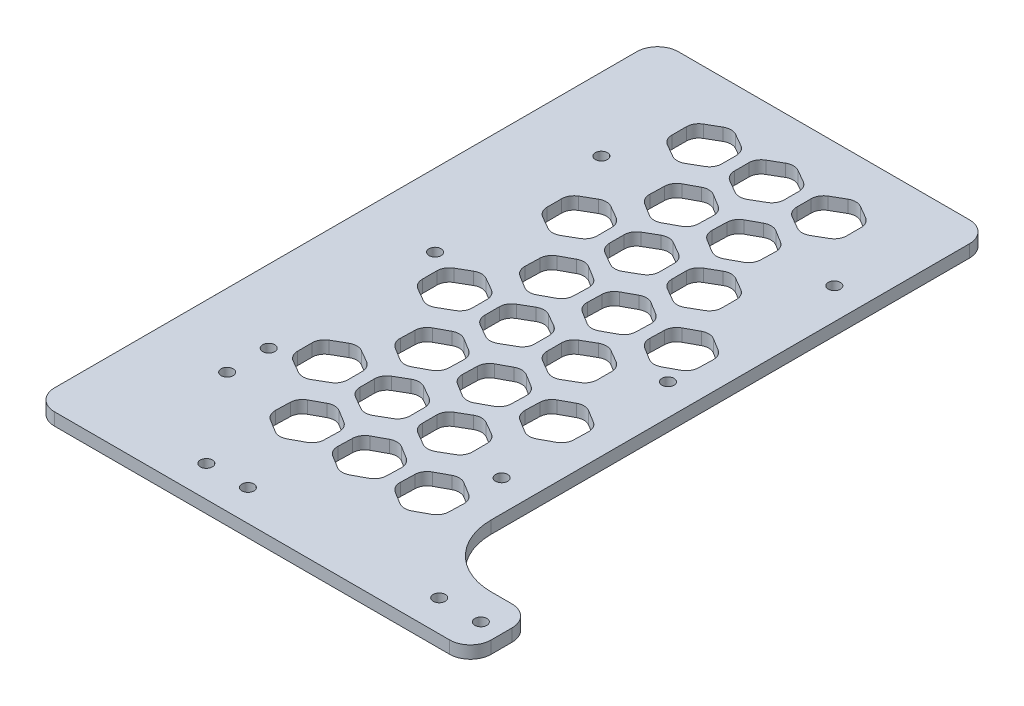
from build123d import *

# Parameters (mm, degrees)
SKETCH_1_R          = 1.45
EXTRUDE_1_DEPTH     = 3
FILLET_1_R          = 5
FILLET_2_R          = 15
SKETCH_2_R          = 1.45
CUT_EXTRUDE_1_DEPTH = 100.292497199
SKETCH_3_R          = 1.45
CUT_EXTRUDE_2_DEPTH = 100.292497199
CUT_EXTRUDE_3_DEPTH = 100.292497199
FILLET_3_R          = 3


with BuildPart() as part:
    # 草图1 → 凸台-拉伸1 (new body)
    with BuildSketch(Plane(origin=(0, 0, 0), x_dir=(1, 0, 0), z_dir=(0, 1, 0))):
        Polygon((40, 75), (40, -60), (65, -60), (65, -75), (40, -75), (-40, -75), (-40, 75), align=None)
        with Locations(Location((50, -67.5, 0), (0, 0, 270))):
            Circle(SKETCH_1_R, mode=Mode.SUBTRACT)
        with Locations(Location((60, -67.5, 0), (0, 0, 270))):
            Circle(SKETCH_1_R, mode=Mode.SUBTRACT)
    extrude(amount=EXTRUDE_1_DEPTH)

    # 圆角1
    fillet_1_edges = [part.edges().sort_by_distance(p)[0] for p in [
        (40, 1.5, -75),
        (65, 1.5, 60),
        (65, 1.5, 75),
        (-40, 1.5, 75),
        (-40, 1.5, -75),
    ]]
    fillet(fillet_1_edges, radius=FILLET_1_R)

    # 圆角2
    fillet_2_edges = [part.edges().sort_by_distance(p)[0] for p in [
        (40, 1.5, 60),
    ]]
    fillet(fillet_2_edges, radius=FILLET_2_R)

    # 草图2 → 切除-拉伸1 (cut, through all)
    with BuildSketch(Plane(origin=(0, 3, 0), x_dir=(1, 0, 0), z_dir=(0, 1, 0))):
        with Locations(Location((4, -67.5, 0), (0, 0, 270))):
            Circle(SKETCH_2_R)
        with Locations(Location((-6, -67.5, 0), (0, 0, 270))):
            Circle(SKETCH_2_R)
        with Locations(Location((-22.5, -46, 0), (0, 0, 270))):
            Circle(SKETCH_2_R)
        with Locations(Location((-22.5, -36, 0), (0, 0, 270))):
            Circle(SKETCH_2_R)
    extrude(amount=-CUT_EXTRUDE_1_DEPTH, mode=Mode.SUBTRACT)

    # 草图3 → 切除-拉伸2 (cut, through all)
    with BuildSketch(Plane(origin=(0, 3, 0), x_dir=(1, 0, 0), z_dir=(0, 1, 0))):
        with Locations(Location((32.5, -35, 0), (0, 0, 270))):
            Circle(SKETCH_3_R)
        with Locations(Location((32.5, 5, 0), (0, 0, 270))):
            Circle(SKETCH_3_R)
        with Locations(Location((32.5, 45, 0), (0, 0, 270))):
            Circle(SKETCH_3_R)
        with Locations(Location((-22.5, 44, 0), (0, 0, 270))):
            Circle(SKETCH_3_R)
        with Locations(Location((-22.5, 4, 0), (0, 0, 270))):
            Circle(SKETCH_3_R)
    extrude(amount=-CUT_EXTRUDE_2_DEPTH, mode=Mode.SUBTRACT)

    # 草图4 → 切除-拉伸3 (cut, through all)
    with BuildSketch(Plane(origin=(0, 3, 0), x_dir=(1, 0, 0), z_dir=(0, 1, 0))):
        Polygon((8.589283576, 62.082534222), (2.589283576, 65.546635837), (-3.410716424, 62.082534222), (-3.410716424, 55.154330992), (2.589283576, 51.690229377), (8.589283576, 55.154330992), align=None)
        Polygon((-6.410716424, 62.082534222), (-12.410716424, 65.546635837), (-18.410716424, 62.082534222), (-18.410716424, 55.154330992), (-12.410716424, 51.690229377), (-6.410716424, 55.154330992), align=None)
        Polygon((3.395495003, 46.736023545), (-2.504116798, 50.368458074), (-8.599703277, 47.075461646), (-8.795677957, 40.150030691), (-2.896066156, 36.517596162), (3.199520323, 39.810592589), align=None)
        Polygon((18.395495003, 46.736023545), (12.495883202, 50.368458074), (6.400296723, 47.075461646), (6.204322043, 40.150030691), (12.103933844, 36.517596162), (18.199520323, 39.810592589), align=None)
        Polygon((23.589283576, 62.082534222), (17.589283576, 65.546635837), (11.589283576, 62.082534222), (11.589283576, 55.154330992), (17.589283576, 51.690229377), (23.589283576, 55.154330992), align=None)
        Polygon((8.589283576, 32.082534222), (2.589283576, 35.546635837), (-3.410716424, 32.082534222), (-3.410716424, 25.154330992), (2.589283576, 21.690229377), (8.589283576, 25.154330992), align=None)
        Polygon((18.395495003, 16.736023545), (12.495883202, 20.368458074), (6.400296723, 17.075461646), (6.204322043, 10.150030691), (12.103933844, 6.517596162), (18.199520323, 9.810592589), align=None)
        Polygon((23.589283576, 32.082534222), (17.589283576, 35.546635837), (11.589283576, 32.082534222), (11.589283576, 25.154330992), (17.589283576, 21.690229377), (23.589283576, 25.154330992), align=None)
        Polygon((33.395495003, 16.736023545), (27.495883202, 20.368458074), (21.400296723, 17.075461646), (21.204322043, 10.150030691), (27.103933844, 6.517596162), (33.199520323, 9.810592589), align=None)
        Polygon((8.589283576, 2.082534222), (2.589283576, 5.546635837), (-3.410716424, 2.082534222), (-3.410716424, -4.845669008), (2.589283576, -8.309770623), (8.589283576, -4.845669008), align=None)
        Polygon((18.395495003, -13.263976455), (12.495883202, -9.631541926), (6.400296723, -12.924538354), (6.204322043, -19.849969309), (12.103933844, -23.482403838), (18.199520323, -20.189407411), align=None)
        Polygon((23.589283576, 2.082534222), (17.589283576, 5.546635837), (11.589283576, 2.082534222), (11.589283576, -4.845669008), (17.589283576, -8.309770623), (23.589283576, -4.845669008), align=None)
        Polygon((33.395495003, -13.263976455), (27.495883202, -9.631541926), (21.400296723, -12.924538354), (21.204322043, -19.849969309), (27.103933844, -23.482403838), (33.199520323, -20.189407411), align=None)
        Polygon((8.589283576, -27.917465778), (2.589283576, -24.453364163), (-3.410716424, -27.917465778), (-3.410716424, -34.845669008), (2.589283576, -38.309770623), (8.589283576, -34.845669008), align=None)
        Polygon((18.395495003, -43.263976455), (12.495883202, -39.631541926), (6.400296723, -42.924538354), (6.204322043, -49.849969309), (12.103933844, -53.482403838), (18.199520323, -50.189407411), align=None)
        Polygon((23.589283576, -27.917465778), (17.589283576, -24.453364163), (11.589283576, -27.917465778), (11.589283576, -34.845669008), (17.589283576, -38.309770623), (23.589283576, -34.845669008), align=None)
        Polygon((33.395495003, -43.263976455), (27.495883202, -39.631541926), (21.400296723, -42.924538354), (21.204322043, -49.849969309), (27.103933844, -53.482403838), (33.199520323, -50.189407411), align=None)
        Polygon((-6.410716424, 32.082534222), (-12.410716424, 35.546635837), (-18.410716424, 32.082534222), (-18.410716424, 25.154330992), (-12.410716424, 21.690229377), (-6.410716424, 25.154330992), align=None)
        Polygon((3.395495003, 16.736023545), (-2.504116798, 20.368458074), (-8.599703277, 17.075461646), (-8.795677957, 10.150030691), (-2.896066156, 6.517596162), (3.199520323, 9.810592589), align=None)
        Polygon((-6.410716424, 2.082534222), (-12.410716424, 5.546635837), (-18.410716424, 2.082534222), (-18.410716424, -4.845669008), (-12.410716424, -8.309770623), (-6.410716424, -4.845669008), align=None)
        Polygon((3.395495003, -13.263976455), (-2.504116798, -9.631541926), (-8.599703277, -12.924538354), (-8.795677957, -19.849969309), (-2.896066156, -23.482403838), (3.199520323, -20.189407411), align=None)
        Polygon((-6.410716424, -27.917465778), (-12.410716424, -24.453364163), (-18.410716424, -27.917465778), (-18.410716424, -34.845669008), (-12.410716424, -38.309770623), (-6.410716424, -34.845669008), align=None)
        Polygon((3.395495003, -43.263976455), (-2.504116798, -39.631541926), (-8.599703277, -42.924538354), (-8.795677957, -49.849969309), (-2.896066156, -53.482403838), (3.199520323, -50.189407411), align=None)
    extrude(amount=-CUT_EXTRUDE_3_DEPTH, mode=Mode.SUBTRACT)

    # 圆角3
    fillet_3_edges = [part.edges().sort_by_distance(p)[0] for p in [
        (23.589283576, 1.5, -62.082534222),
        (23.589283576, 1.5, -55.154330992),
        (17.589283576, 1.5, -51.690229377),
        (11.589283576, 1.5, -55.154330992),
        (11.589283576, 1.5, -62.082534222),
        (17.589283576, 1.5, -65.546635837),
        (18.395495003, 1.5, -46.736023545),
        (18.199520323, 1.5, -39.810592589),
        (12.103933844, 1.5, -36.517596162),
        (6.204322043, 1.5, -40.150030691),
        (6.400296723, 1.5, -47.075461646),
        (12.495883202, 1.5, -50.368458074),
        (8.589283576, 1.5, -62.082534222),
        (8.589283576, 1.5, -55.154330992),
        (2.589283576, 1.5, -51.690229377),
        (-3.410716424, 1.5, -55.154330992),
        (-3.410716424, 1.5, -62.082534222),
        (2.589283576, 1.5, -65.546635837),
        (3.395495003, 1.5, -46.736023545),
        (3.199520323, 1.5, -39.810592589),
        (-2.896066156, 1.5, -36.517596162),
        (-8.795677957, 1.5, -40.150030691),
        (-8.599703277, 1.5, -47.075461646),
        (-2.504116798, 1.5, -50.368458074),
        (33.395495003, 1.5, -16.736023545),
        (33.199520323, 1.5, -9.810592589),
        (27.103933844, 1.5, -6.517596162),
        (21.204322043, 1.5, -10.150030691),
        (21.400296723, 1.5, -17.075461646),
        (27.495883202, 1.5, -20.368458074),
        (23.589283576, 1.5, -32.082534222),
        (23.589283576, 1.5, -25.154330992),
        (17.589283576, 1.5, -21.690229377),
        (11.589283576, 1.5, -25.154330992),
        (11.589283576, 1.5, -32.082534222),
        (17.589283576, 1.5, -35.546635837),
        (18.395495003, 1.5, -16.736023545),
        (18.199520323, 1.5, -9.810592589),
        (12.103933844, 1.5, -6.517596162),
        (6.204322043, 1.5, -10.150030691),
        (6.400296723, 1.5, -17.075461646),
        (12.495883202, 1.5, -20.368458074),
        (8.589283576, 1.5, -32.082534222),
        (8.589283576, 1.5, -25.154330992),
        (2.589283576, 1.5, -21.690229377),
        (-3.410716424, 1.5, -25.154330992),
        (-3.410716424, 1.5, -32.082534222),
        (2.589283576, 1.5, -35.546635837),
        (33.395495003, 1.5, 13.263976455),
        (33.199520323, 1.5, 20.189407411),
        (27.103933844, 1.5, 23.482403838),
        (21.204322043, 1.5, 19.849969309),
        (21.400296723, 1.5, 12.924538354),
        (27.495883202, 1.5, 9.631541926),
        (23.589283576, 1.5, -2.082534222),
        (23.589283576, 1.5, 4.845669008),
        (17.589283576, 1.5, 8.309770623),
        (11.589283576, 1.5, 4.845669008),
        (11.589283576, 1.5, -2.082534222),
        (17.589283576, 1.5, -5.546635837),
        (18.395495003, 1.5, 13.263976455),
        (18.199520323, 1.5, 20.189407411),
        (12.103933844, 1.5, 23.482403838),
        (6.204322043, 1.5, 19.849969309),
        (6.400296723, 1.5, 12.924538354),
        (12.495883202, 1.5, 9.631541926),
        (8.589283576, 1.5, -2.082534222),
        (8.589283576, 1.5, 4.845669008),
        (2.589283576, 1.5, 8.309770623),
        (-3.410716424, 1.5, 4.845669008),
        (-3.410716424, 1.5, -2.082534222),
        (2.589283576, 1.5, -5.546635837),
        (33.395495003, 1.5, 43.263976455),
        (33.199520323, 1.5, 50.189407411),
        (27.103933844, 1.5, 53.482403838),
        (21.204322043, 1.5, 49.849969309),
        (21.400296723, 1.5, 42.924538354),
        (27.495883202, 1.5, 39.631541926),
        (23.589283576, 1.5, 27.917465778),
        (23.589283576, 1.5, 34.845669008),
        (17.589283576, 1.5, 38.309770623),
        (11.589283576, 1.5, 34.845669008),
        (11.589283576, 1.5, 27.917465778),
        (17.589283576, 1.5, 24.453364163),
        (18.395495003, 1.5, 43.263976455),
        (18.199520323, 1.5, 50.189407411),
        (12.103933844, 1.5, 53.482403838),
        (6.204322043, 1.5, 49.849969309),
        (6.400296723, 1.5, 42.924538354),
        (12.495883202, 1.5, 39.631541926),
        (8.589283576, 1.5, 27.917465778),
        (8.589283576, 1.5, 34.845669008),
        (2.589283576, 1.5, 38.309770623),
        (-3.410716424, 1.5, 34.845669008),
        (-3.410716424, 1.5, 27.917465778),
        (2.589283576, 1.5, 24.453364163),
        (-6.410716424, 1.5, -32.082534222),
        (-6.410716424, 1.5, -25.154330992),
        (-12.410716424, 1.5, -21.690229377),
        (-18.410716424, 1.5, -25.154330992),
        (-18.410716424, 1.5, -32.082534222),
        (-12.410716424, 1.5, -35.546635837),
        (3.395495003, 1.5, -16.736023545),
        (3.199520323, 1.5, -9.810592589),
        (-2.896066156, 1.5, -6.517596162),
        (-8.795677957, 1.5, -10.150030691),
        (-8.599703277, 1.5, -17.075461646),
        (-2.504116798, 1.5, -20.368458074),
        (-6.410716424, 1.5, -2.082534222),
        (-6.410716424, 1.5, 4.845669008),
        (-12.410716424, 1.5, 8.309770623),
        (-18.410716424, 1.5, 4.845669008),
        (-18.410716424, 1.5, -2.082534222),
        (-12.410716424, 1.5, -5.546635837),
        (3.395495003, 1.5, 13.263976455),
        (3.199520323, 1.5, 20.189407411),
        (-2.896066156, 1.5, 23.482403838),
        (-8.795677957, 1.5, 19.849969309),
        (-8.599703277, 1.5, 12.924538354),
        (-2.504116798, 1.5, 9.631541926),
        (-6.410716424, 1.5, 27.917465778),
        (-6.410716424, 1.5, 34.845669008),
        (-12.410716424, 1.5, 38.309770623),
        (-18.410716424, 1.5, 34.845669008),
        (-18.410716424, 1.5, 27.917465778),
        (-12.410716424, 1.5, 24.453364163),
        (3.395495003, 1.5, 43.263976455),
        (3.199520323, 1.5, 50.189407411),
        (-2.896066156, 1.5, 53.482403838),
        (-8.795677957, 1.5, 49.849969309),
        (-8.599703277, 1.5, 42.924538354),
        (-2.504116798, 1.5, 39.631541926),
        (-6.410716424, 1.5, -62.082534222),
        (-6.410716424, 1.5, -55.154330992),
        (-12.410716424, 1.5, -51.690229377),
        (-18.410716424, 1.5, -55.154330992),
        (-18.410716424, 1.5, -62.082534222),
        (-12.410716424, 1.5, -65.546635837),
    ]]
    fillet(fillet_3_edges, radius=FILLET_3_R)


solid = part.part
